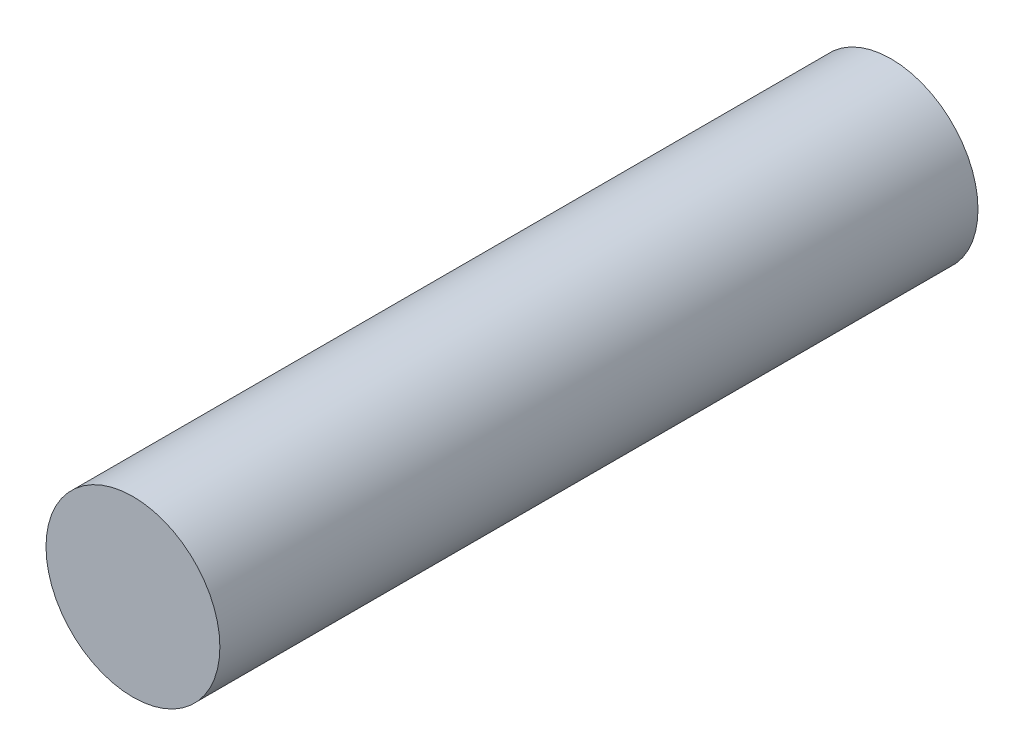
from build123d import *

# Parameters (mm, degrees)
SKETCH1_R           = 12.5
BOSS_EXTRUDE1_DEPTH = 54.5


with BuildPart() as part:
    # Sketch1 → Boss-Extrude1 (new, symmetric)
    with BuildSketch(Plane.XY):
        Circle(SKETCH1_R)
    extrude(amount=BOSS_EXTRUDE1_DEPTH, both=True)


solid = part.part
